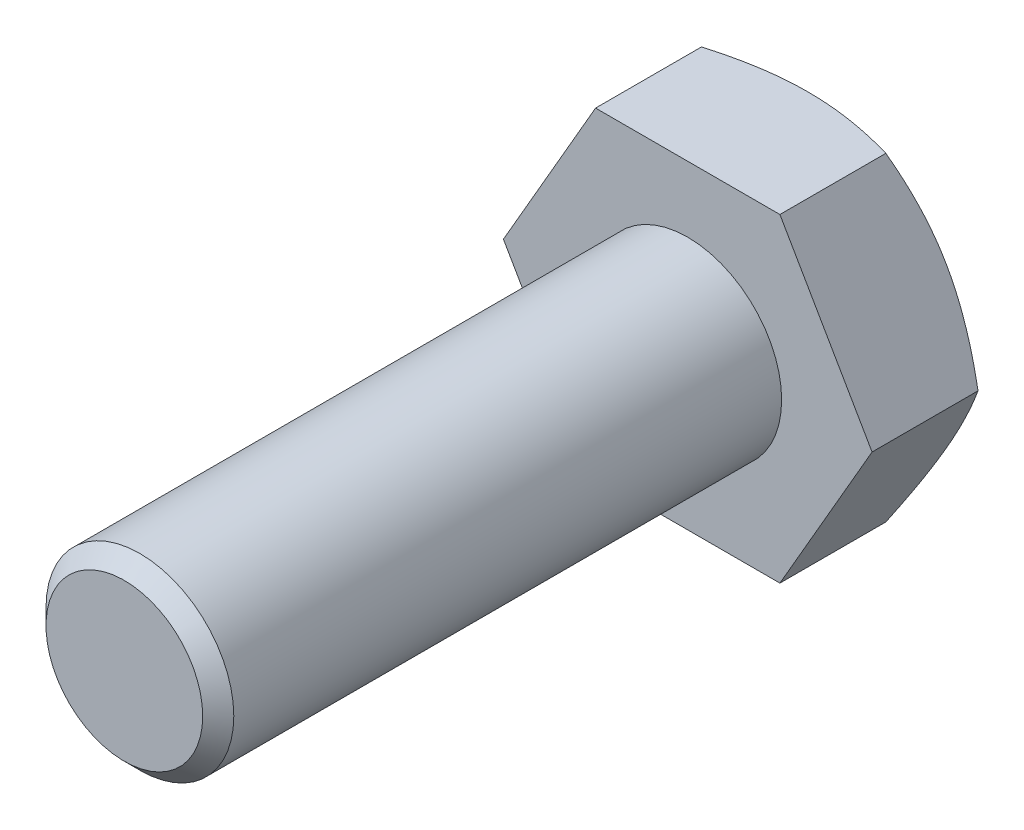
from build123d import *

# Parameters (mm, degrees)
EXTRUDE_1_DEPTH = 6.4
SKETCH_2_R      = 5
EXTRUDE_2_DEPTH = 30
CHAMFER_1_SIZE  = 0.828


with BuildPart() as part:
    # Эскиз1 → Бобышка-Вытянуть1 (new body)
    with BuildSketch(Plane.XY):
        Polygon((-4.907477288, 8.5), (-9.814954576, 0), (-4.907477288, -8.5), (4.907477288, -8.5), (9.814954576, 0), (4.907477288, 8.5), align=None)
    extrude(amount=EXTRUDE_1_DEPTH)

    # Эскиз2 → Бобышка-Вытянуть2 (add)
    with BuildSketch(Plane.XY.offset(6.4)):
        Circle(SKETCH_2_R)
    extrude(amount=EXTRUDE_2_DEPTH)

    # Эскиз3 → Вырез-Повернуть1 (revolve, cut)
    with BuildSketch(Plane(origin=(0, 0, 0), x_dir=(0, 0, -1), z_dir=(1, 0, 0))):
        Polygon((0, 8.5), (0, 11.5), (-1.732050808, 11.5), align=None)
    revolve(axis=Axis((0, 0, 1000), (0, 0, -1)), mode=Mode.SUBTRACT)

    # Фаска1
    chamfer_1_edges = [part.edges().sort_by_distance(p)[0] for p in [
        (-5, 0, 36.4),
    ]]
    chamfer(chamfer_1_edges, length=CHAMFER_1_SIZE)


solid = part.part
